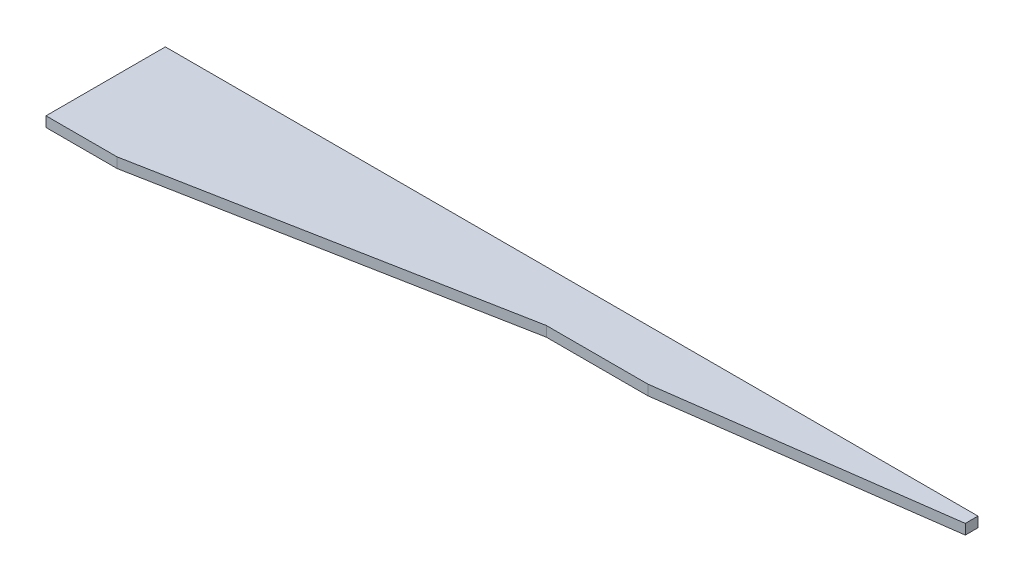
from build123d import *

# Parameters (mm, degrees)
BOSS_EXTRUDE1_DEPTH = 4


with BuildPart() as part:
    # Sketch1 → Boss-Extrude1 (new body)
    with BuildSketch(Plane(origin=(0, 0, 0), x_dir=(1, 0, 0), z_dir=(0, 1, 0))):
        Polygon((0, 0), (0, -47), (28, -47), (170, -20), (210, -20), (320, -5), (320, 0), align=None)
    extrude(amount=BOSS_EXTRUDE1_DEPTH)


solid = part.part
